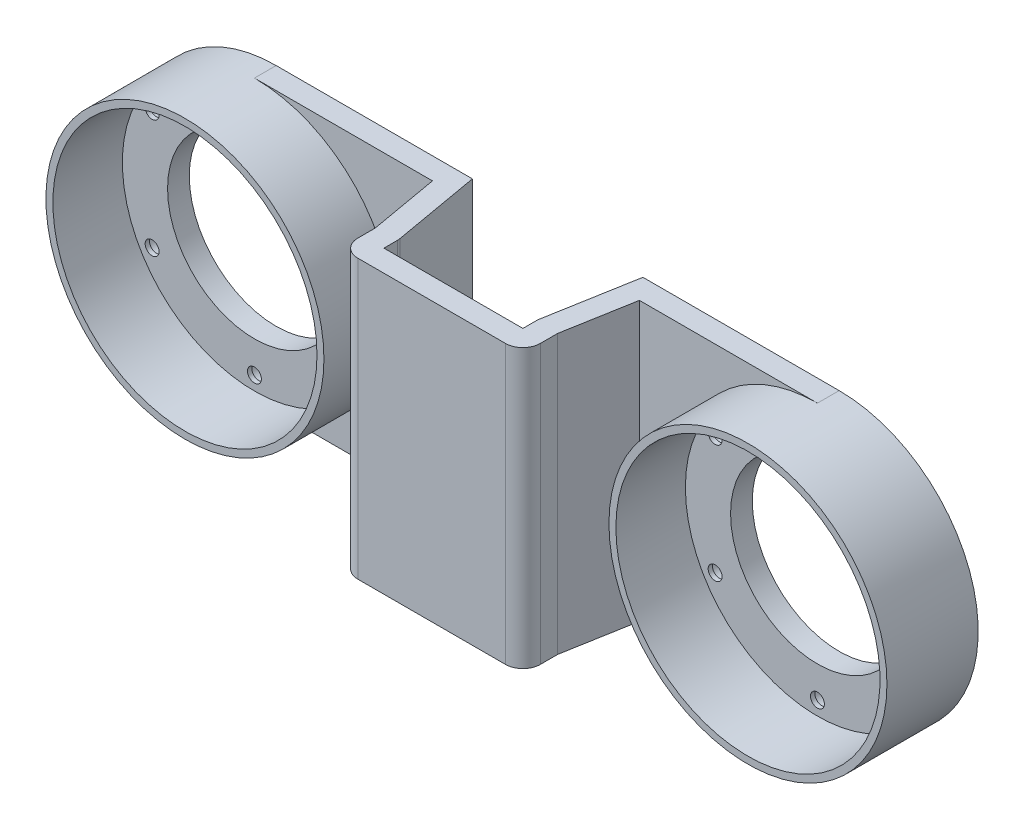
from build123d import *
from build123d.topology import SkipClean

# Parameters (mm, degrees)
SKETCH1_R           = 2
BOSS_EXTRUDE1_DEPTH = 25
SKETCH2_R           = 3
CUT_EXTRUDE2_DEPTH  = 5
CUT_EXTRUDE3_DEPTH  = 162.5
BOSS_EXTRUDE2_START = 20
SKETCH6_R           = 40
SKETCH6_R_2         = 38
BOSS_EXTRUDE2_DEPTH = 20
FILLET1_R           = 5


with BuildPart() as part:
    # Sketch1 → Boss-Extrude1 (new, symmetric)
    with BuildSketch(Plane.XY):
        with BuildLine():
            Line((80, -40), (0, -40))
            ThreePointArc((0, -40), (-40, 0), (0, 40))
            Line((0, 40), (80, 40))
            Line((80, 40), (82, 40))
            Line((82, 40), (162, 40))
            ThreePointArc((162, 40), (202, 0), (162, -40))
            Line((162, -40), (82, -40))
            Line((82, -40), (80, -40))
        make_face()
        with Locations((0, 34)):
            Circle(SKETCH1_R, mode=Mode.SUBTRACT)
        with Locations((29.444863729, 17)):
            Circle(SKETCH1_R, mode=Mode.SUBTRACT)
        with Locations((29.444863729, -17)):
            Circle(SKETCH1_R, mode=Mode.SUBTRACT)
        with Locations((0, -34)):
            Circle(SKETCH1_R, mode=Mode.SUBTRACT)
        with Locations((-29.444863729, -17)):
            Circle(SKETCH1_R, mode=Mode.SUBTRACT)
        with Locations((-29.444863729, 17)):
            Circle(SKETCH1_R, mode=Mode.SUBTRACT)
        with Locations(Location((162, -34, 0), (0, 0, 180))):
            Circle(SKETCH1_R, mode=Mode.SUBTRACT)
        with Locations(Location((191.444863729, 17, 0), (0, 0, 180))):
            Circle(SKETCH1_R, mode=Mode.SUBTRACT)
        with Locations(Location((191.444863729, -17, 0), (0, 0, 180))):
            Circle(SKETCH1_R, mode=Mode.SUBTRACT)
        with Locations(Location((132.555136271, -17, 0), (0, 0, 180))):
            Circle(SKETCH1_R, mode=Mode.SUBTRACT)
        with Locations(Location((132.555136271, 17, 0), (0, 0, 180))):
            Circle(SKETCH1_R, mode=Mode.SUBTRACT)
        with Locations(Location((162, 34, 0), (0, 0, 180))):
            Circle(SKETCH1_R, mode=Mode.SUBTRACT)
        with BuildLine():
            ThreePointArc((25, 0), (0, 25), (-25, 0))
            ThreePointArc((-25, 0), (0, -25), (25, 0))
        make_face(mode=Mode.SUBTRACT)
        with BuildLine():
            ThreePointArc((187, 0), (162, -25), (137, 0))
            ThreePointArc((137, 0), (162, 25), (187, 0))
        make_face(mode=Mode.SUBTRACT)
    extrude(amount=BOSS_EXTRUDE1_DEPTH, both=True)

    # Sketch2 → Cut-Extrude2 (cut)
    with BuildSketch(Plane(origin=(0, 0, -25), x_dir=(-1, 0, 0), z_dir=(0, 0, -1))):
        with Locations((-162, 34)):
            Circle(SKETCH2_R)
        with Locations((-132.555136271, 17)):
            Circle(SKETCH2_R)
        with Locations((-132.555136271, -17)):
            Circle(SKETCH2_R)
        with Locations((-162, -34)):
            Circle(SKETCH2_R)
        with Locations((-191.444863729, -17)):
            Circle(SKETCH2_R)
        with Locations((-191.444863729, 17)):
            Circle(SKETCH2_R)
        with Locations(Location((29.444863729, 17, 0), (0, 0, 180))):
            Circle(SKETCH2_R)
        with Locations(Location((29.444863729, -17, 0), (0, 0, 180))):
            Circle(SKETCH2_R)
        with Locations(Location((0, -34, 0), (0, 0, 180))):
            Circle(SKETCH2_R)
        with Locations(Location((-29.444863729, -17, 0), (0, 0, 180))):
            Circle(SKETCH2_R)
        with Locations(Location((-29.444863729, 17, 0), (0, 0, 180))):
            Circle(SKETCH2_R)
        with Locations(Location((0, 34, 0), (0, 0, 180))):
            Circle(SKETCH2_R)
    extrude(amount=-CUT_EXTRUDE2_DEPTH, mode=Mode.SUBTRACT)

    # Sketch5 → Cut-Extrude3 (cut, symmetric)
    with BuildSketch(Plane(origin=(0, 0, 0), x_dir=(1, 0, 0), z_dir=(0, 1, 0))):
        Polygon((61, -0.703195853), (61, -5), (101, -5), (101, -0.703195853), (105.532166919, 25), (56.467833081, 25), align=None)
        Polygon((54.75, -1.25), (51.223460386, 18.75), (-40, 18.75), (-40, -25), (202, -25), (202, 18.75), (110.776539614, 18.75), (107.25, -1.25), (107.25, -11.25), (54.75, -11.25), align=None)
    extrude(amount=CUT_EXTRUDE3_DEPTH, both=True, mode=Mode.SUBTRACT)

    # Sketch6 → Boss-Extrude2 (add)
    # profile 1 of 2: a face of its own
    with SkipClean():  # the faces are left unmerged after this step: merging them gives an invalid solid
        with BuildSketch(Plane.XY.offset(-18.75).offset(BOSS_EXTRUDE2_START)):
            with Locations(Location((0, 0, 0), (0, 0, 270))):
                Circle(SKETCH6_R)
            Circle(SKETCH6_R_2, mode=Mode.SUBTRACT)
        # profile 2 of 2: a face of its own
        with BuildSketch(Plane.XY.offset(-18.75).offset(BOSS_EXTRUDE2_START)):
            with Locations(Location((162, 0, 0), (0, 0, 180))):
                Circle(SKETCH6_R)
            with Locations(Location((162, 0, 0), (0, 0, 180))):
                Circle(SKETCH6_R_2, mode=Mode.SUBTRACT)
        extrude(amount=-BOSS_EXTRUDE2_DEPTH)

    # Fillet1
    fillet1_edges = [part.edges().sort_by_distance(p)[0] for p in [
        (54.75, 0, 11.25),
        (107.25, 0, 11.25),
        (61, 0, 0.703195853),
        (101, 0, 0.703195853),
    ]]
    fillet(fillet1_edges, radius=FILLET1_R)


solid = part.part
